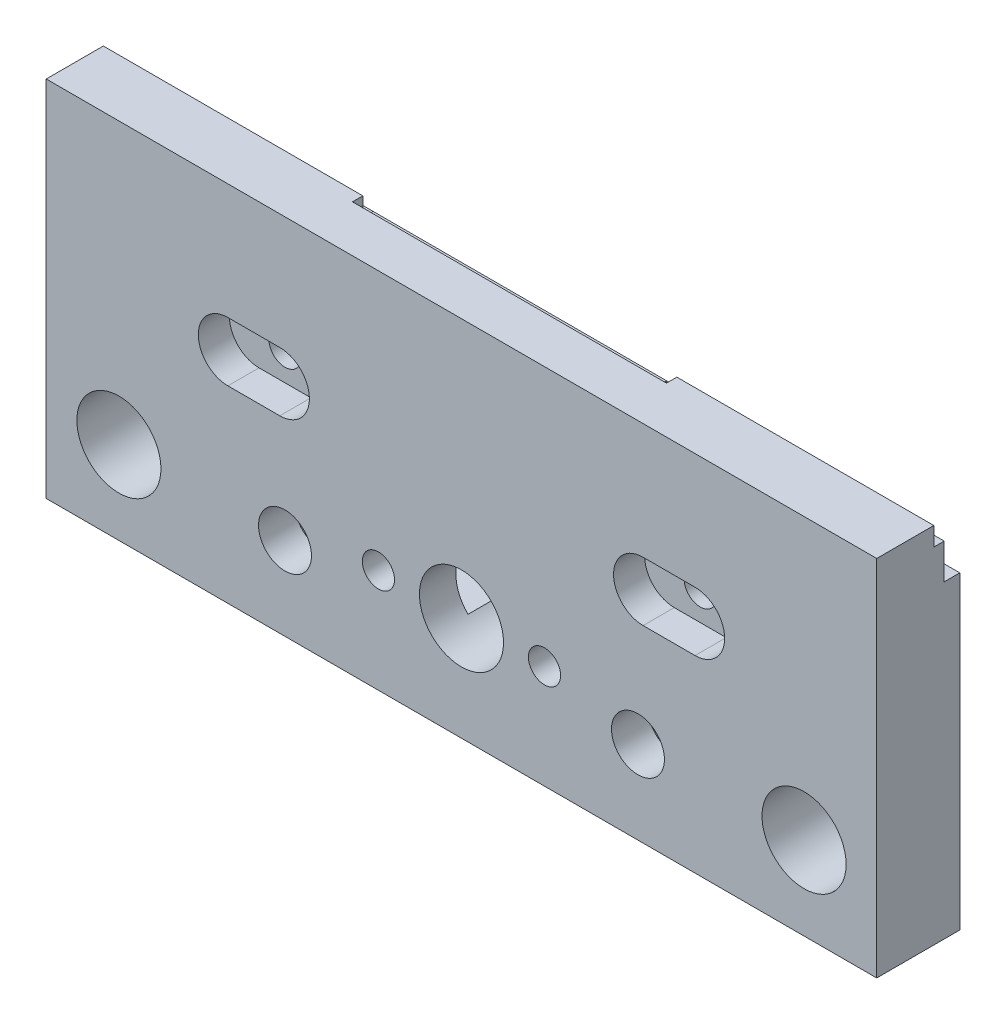
from build123d import *

# Parameters (mm, degrees)
SKETCH_2_W           = 80
SKETCH_2_H           = 35
SKETCH_2_R           = 4.05
EXTRUDE_1_DEPTH      = 8
SKETCH_3_R           = 2.55
CUT_EXTRUDE_1_DEPTH  = 88.686943156
CUT_EXTRUDE_2_DEPTH  = 88.686943156
SKETCH_5_R           = 1.55
CUT_EXTRUDE_3_DEPTH  = 88.686943156
CUT_EXTRUDE_4_DEPTH  = 4.5
CUT_EXTRUDE_5_DEPTH  = 4.5
SKETCH_11_R          = 1.55
CUT_EXTRUDE_7_DEPTH  = 88.686943156
CUT_EXTRUDE_8_DEPTH  = 3
CUT_EXTRUDE_START    = -3
CUT_EXTRUDE_9_DEPTH  = 3
CUT_EXTRUDE_11_DEPTH = 1


with BuildPart() as part:
    # 草图2 → 凸台-拉伸1 (new body)
    with BuildSketch(Plane.XY):
        with Locations((40, 17.5)):
            Rectangle(SKETCH_2_W, SKETCH_2_H)
        with Locations((7, 8)):
            Circle(SKETCH_2_R, mode=Mode.SUBTRACT)
        with Locations((40, 10)):
            Circle(SKETCH_2_R, mode=Mode.SUBTRACT)
        with Locations((73, 8)):
            Circle(SKETCH_2_R, mode=Mode.SUBTRACT)
    extrude(amount=EXTRUDE_1_DEPTH)

    # 草图3 → 切除-拉伸1 (cut, through all)
    with BuildSketch(Plane.XY.offset(8)):
        with Locations((23, 8)):
            Circle(SKETCH_3_R)
        with Locations((57, 8)):
            Circle(SKETCH_3_R)
    extrude(amount=-CUT_EXTRUDE_1_DEPTH, mode=Mode.SUBTRACT)

    # 草图4 → 切除-拉伸2 (cut, through all)
    with BuildSketch(Plane(origin=(80, 0, 0), x_dir=(0, 0, -1), z_dir=(1, 0, 0))):
        Polygon((-1.5, 33.2), (-2.5, 33.2), (-2.5, 35), (0, 35), (0, 29.8), (-1.5, 29.8), align=None)
    extrude(amount=-CUT_EXTRUDE_2_DEPTH, mode=Mode.SUBTRACT)

    # 草图5 → 切除-拉伸3 (cut, through all)
    with BuildSketch(Plane.XY.offset(8)):
        with Locations((48, 10)):
            Circle(SKETCH_5_R)
        with Locations((32, 10)):
            Circle(SKETCH_5_R)
    extrude(amount=-CUT_EXTRUDE_3_DEPTH, mode=Mode.SUBTRACT)

    # 草图7 → 切除-拉伸4 (cut)
    with BuildSketch(Plane(origin=(0, 0, 0), x_dir=(-1, 0, 0), z_dir=(0, 0, -1))):
        with BuildLine():
            Line((-27.05, 10), (-27.05, 2.5))
            ThreePointArc((-27.05, 2.5), (-27.782233047, 0.732233047), (-29.55, 0))
            Line((-29.55, 0), (-16.45, 0))
            ThreePointArc((-16.45, 0), (-18.217766953, 0.732233047), (-18.95, 2.5))
            Line((-18.95, 2.5), (-18.95, 10))
            ThreePointArc((-18.95, 10), (-23, 14.05), (-27.05, 10))
        make_face()
        with BuildLine():
            Line((-61.05, 2.5), (-61.05, 10))
            ThreePointArc((-61.05, 10), (-57, 14.05), (-52.95, 10))
            Line((-52.95, 10), (-52.95, 2.5))
            ThreePointArc((-52.95, 2.5), (-52.217766953, 0.732233047), (-50.45, 0))
            Line((-50.45, 0), (-63.55, 0))
            ThreePointArc((-63.55, 0), (-61.782233047, 0.732233047), (-61.05, 2.5))
        make_face()
    extrude(amount=-CUT_EXTRUDE_4_DEPTH, mode=Mode.SUBTRACT)

    # 草图8 → 切除-拉伸5 (cut)
    with BuildSketch(Plane(origin=(0, 0, 0), x_dir=(-1, 0, 0), z_dir=(0, 0, -1))):
        with BuildLine():
            Line((-30.5, 12.85), (-49.5, 12.85))
            ThreePointArc((-49.5, 12.85), (-52.35, 10), (-49.5, 7.15))
            Line((-49.5, 7.15), (-30.5, 7.15))
            ThreePointArc((-30.5, 7.15), (-27.65, 10), (-30.5, 12.85))
        make_face()
    extrude(amount=-CUT_EXTRUDE_5_DEPTH, mode=Mode.SUBTRACT)

    # 草图11 → 切除-拉伸7 (cut, through all)
    with BuildSketch(Plane(origin=(0, 0, 0), x_dir=(-1, 0, 0), z_dir=(0, 0, -1))):
        with Locations((-60, 21)):
            Circle(SKETCH_11_R)
        with Locations((-20, 21)):
            Circle(SKETCH_11_R)
    extrude(amount=-CUT_EXTRUDE_7_DEPTH, mode=Mode.SUBTRACT)

    # 草图12 → 切除-拉伸8 (cut)
    with BuildSketch(Plane(origin=(0, 0, 0), x_dir=(-1, 0, 0), z_dir=(0, 0, -1))):
        with BuildLine():
            Line((-62.5, 18.15), (-57.5, 18.15))
            ThreePointArc((-57.5, 18.15), (-54.65, 21), (-57.5, 23.85))
            Line((-57.5, 23.85), (-62.5, 23.85))
            ThreePointArc((-62.5, 23.85), (-65.35, 21), (-62.5, 18.15))
        make_face()
        with BuildLine():
            Line((-17.5, 23.85), (-22.5, 23.85))
            ThreePointArc((-22.5, 23.85), (-25.35, 21), (-22.5, 18.15))
            Line((-22.5, 18.15), (-17.5, 18.15))
            ThreePointArc((-17.5, 18.15), (-14.65, 21), (-17.5, 23.85))
        make_face()
    extrude(amount=-CUT_EXTRUDE_8_DEPTH, mode=Mode.SUBTRACT)

    # 草图15 → 切除-拉伸9 (cut)
    with BuildSketch(Plane.XY.offset(8).offset(CUT_EXTRUDE_START)):
        with BuildLine():
            Line((57.5, 18.15), (62.5, 18.15))
            ThreePointArc((62.5, 18.15), (65.35, 21), (62.5, 23.85))
            Line((62.5, 23.85), (57.5, 23.85))
            ThreePointArc((57.5, 23.85), (54.65, 21), (57.5, 18.15))
        make_face()
        with BuildLine():
            Line((22.5, 23.85), (17.5, 23.85))
            ThreePointArc((17.5, 23.85), (14.65, 21), (17.5, 18.15))
            Line((17.5, 18.15), (22.5, 18.15))
            ThreePointArc((22.5, 18.15), (25.35, 21), (22.5, 23.85))
        make_face()
    extrude(amount=CUT_EXTRUDE_9_DEPTH, mode=Mode.SUBTRACT)

    # 草图19 → 切除-拉伸11 (cut, symmetric)
    with BuildSketch(Plane(origin=(0, 0, 2.5), x_dir=(-1, 0, 0), z_dir=(0, 0, -1))):
        with BuildLine():
            Line((-25, 35), (-55.247938178, 35))
            Line((-55.247938178, 35), (-55.247938178, 34.2))
            ThreePointArc((-55.247938178, 34.2), (-54.747938178, 33.7), (-54.247938178, 34.2))
            Line((-54.247938178, 34.2), (-26, 34.2))
            ThreePointArc((-26, 34.2), (-25.5, 33.7), (-25, 34.2))
            Line((-25, 34.2), (-25, 35))
        make_face()
    extrude(amount=CUT_EXTRUDE_11_DEPTH, both=True, mode=Mode.SUBTRACT)


solid = part.part
